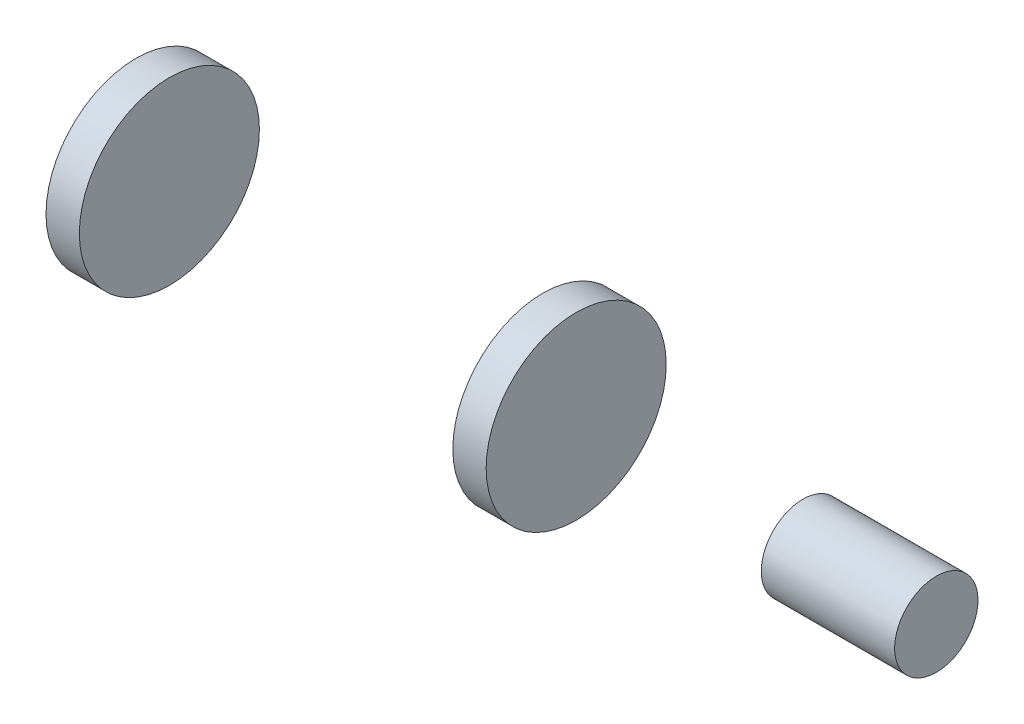
from build123d import *

# Parameters (mm, degrees)
SKETCH_1_R      = 12.5
EXTRUDE_1_DEPTH = 40
SKETCH_2_R      = 27
EXTRUDE_2_DEPTH = 10
SKETCH_3_R      = 27
EXTRUDE_3_DEPTH = 10


with BuildPart() as part:
    # 草图1 → 凸台-拉伸1 (new body)
    with BuildSketch(Plane(origin=(300, 0, 0), x_dir=(0, 0, -1), z_dir=(1, 0, 0))):
        Circle(SKETCH_1_R)
    extrude(amount=EXTRUDE_1_DEPTH)


with BuildPart() as body_2:
    # 草图2 → 凸台-拉伸2 (new body)
    with BuildSketch(Plane.ZY.offset(-100)):
        Circle(SKETCH_2_R)
    extrude(amount=-EXTRUDE_2_DEPTH)


with BuildPart() as body_3:
    # 草图3 → 凸台-拉伸3 (new body)
    with BuildSketch(Plane(origin=(232, 0, 0), x_dir=(0, 0, -1), z_dir=(1, 0, 0))):
        Circle(SKETCH_3_R)
    extrude(amount=-EXTRUDE_3_DEPTH)


solid = Compound([part.part, body_2.part, body_3.part])
